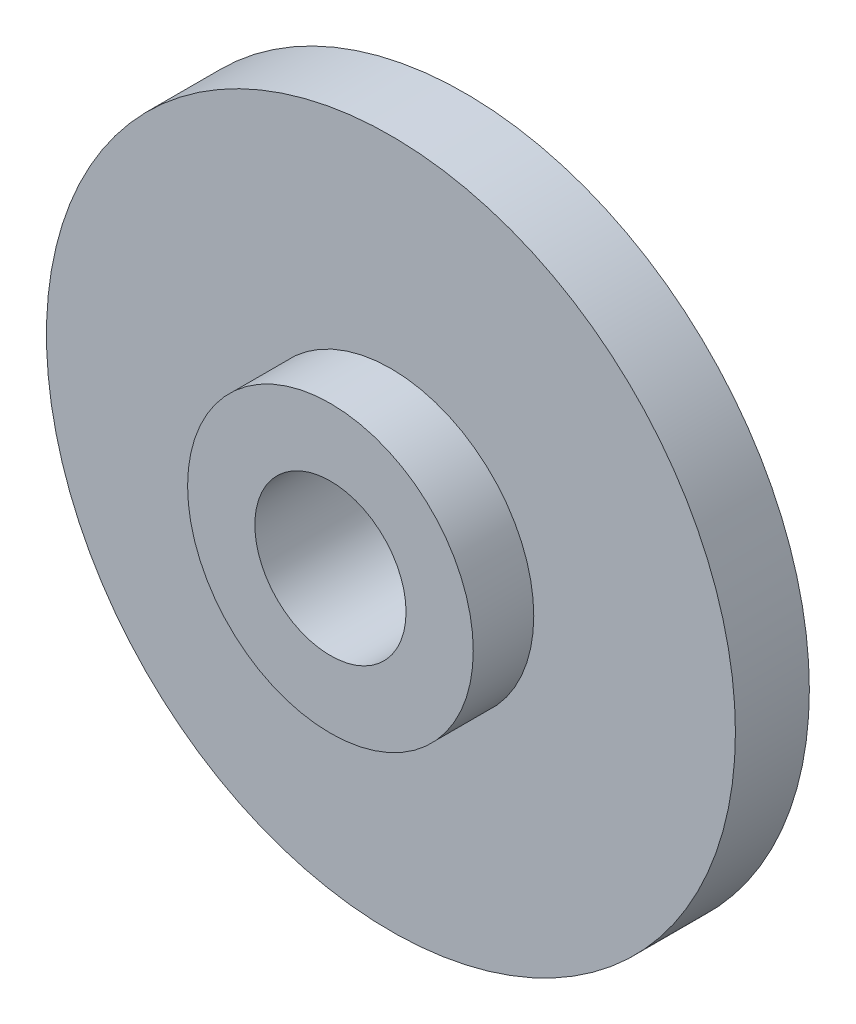
from build123d import *

# Parameters (mm, degrees)
SKETCH1_R           = 10.25
SKETCH1_R_2         = 4.25
BOSS_EXTRUDE1_DEPTH = 2.2
SKETCH1_3_R         = 4.25
SKETCH1_3_R_2       = 2.25
BOSS_EXTRUDE2_DEPTH = 4


with BuildPart() as part:
    # Sketch1 → Boss-Extrude1 (new body)
    with BuildSketch(Plane.XY):
        Circle(SKETCH1_R)
        Circle(SKETCH1_R_2, mode=Mode.SUBTRACT)
    extrude(amount=BOSS_EXTRUDE1_DEPTH)

    # Sketch1<3> → Boss-Extrude2 (add)
    with BuildSketch(Plane.XY):
        Circle(SKETCH1_3_R)
        Circle(SKETCH1_3_R_2, mode=Mode.SUBTRACT)
    extrude(amount=BOSS_EXTRUDE2_DEPTH)


solid = part.part
